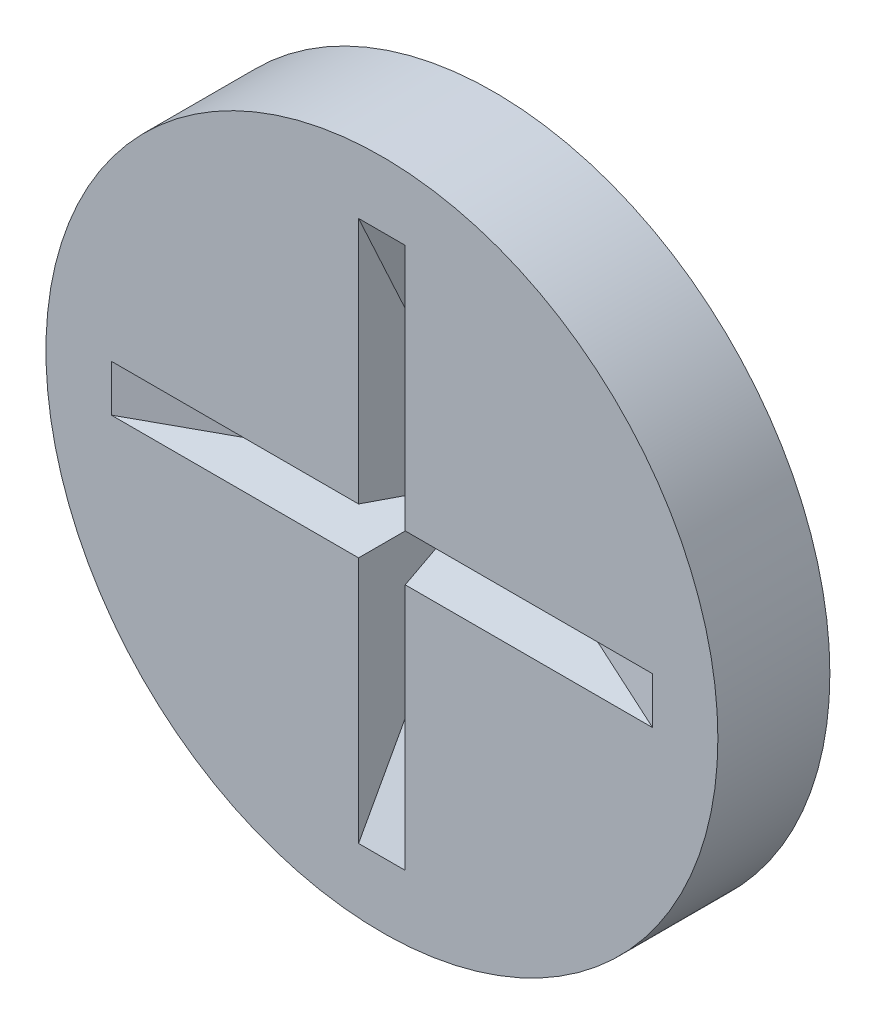
from build123d import *

# Parameters (mm, degrees)
SKETCH_2_R               = 3.6
EXTRUDE_1_DEPTH          = 1.2
SKETCH_3_R               = 1
EXTRUDE_2_DEPTH          = 1.2
PATTERN_CIRCULAR_2_COUNT = 4


with BuildPart() as part:
    # 草圖2 → 伸長1 (new body)
    with BuildSketch(Plane.XY):
        Circle(SKETCH_2_R)
    extrude(amount=EXTRUDE_1_DEPTH)

    # 草圖3 → 伸長2 (add)
    with BuildSketch(Plane(origin=(0, 0, 0), x_dir=(-1, 0, 0), z_dir=(0, 0, -1))):
        with Locations(Location((0, 0, 0), (0, 0, 180))):
            Circle(SKETCH_3_R)
    extrude(amount=EXTRUDE_2_DEPTH)

    # 草圖4 → 除料-疊層拉伸1 section 0
    with BuildSketch(Plane.XY.offset(1.2), mode=Mode.PRIVATE) as loft_1_s0:
        with BuildLine():
            Line((-0.25, 2.9), (0.25, 2.9))
            Line((0.25, 2.9), (0.25, -2.9))
            Line((0.25, -2.9), (-0.25, -2.9))
            Line((-0.25, -2.9), (-0.25, 2.9))
        make_face()
    loft_1 = loft([loft_1_s0.sketch, Vertex(0, 0, 0)], mode=Mode.SUBTRACT)

    # 環狀複製排列2: 除料-疊層拉伸1 ×4 about axis
    pattern_circular_2_axis = Axis((0, 0, 0), (0, 0, 1))
    for i in range(1, PATTERN_CIRCULAR_2_COUNT):
        add(loft_1.rotate(pattern_circular_2_axis, i * 360 / PATTERN_CIRCULAR_2_COUNT), mode=Mode.SUBTRACT)


solid = part.part
